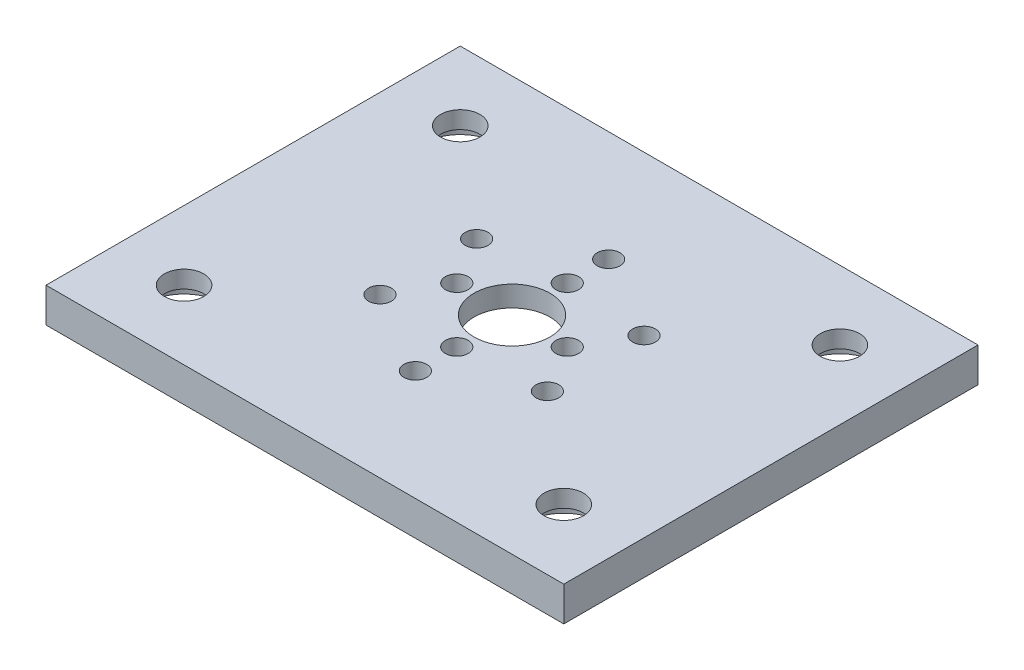
from build123d import *

# Parameters (mm, degrees)
SKETCH_1_W               = 75
SKETCH_1_H               = 60
EXTRUDE_1_DEPTH          = 5
HOLE_WIZARD_1_D          = 5.7
CUT_EXTRUDE_1_DEPTH      = 10
HOLE_WIZARD_2_D          = 3.3
PATTERN_CIRCULAR_1_COUNT = 6
HOLE_WIZARD_3_D          = 11
HOLE_WIZARD_3_DEPTH      = 2.5
HOLE_WIZARD_4_D          = 3.3
HOLE_WIZARD_5_D          = 23
HOLE_WIZARD_5_DEPTH      = 2


with BuildPart() as part:
    # 草图1 → 凸台-拉伸1 (new body)
    with BuildSketch(Plane(origin=(0, 0, 0), x_dir=(1, 0, 0), z_dir=(0, 1, 0))):
        with Locations((37.5, 30)):
            Rectangle(SKETCH_1_W, SKETCH_1_H)
    extrude(amount=EXTRUDE_1_DEPTH)

    # 孔1 (through all)
    with Locations(Plane(origin=(0, 5, 0), x_dir=(1, 0, 0), z_dir=(0, 1, 0))):
        with Locations((10, 50), (10, 10), (65, 10), (65, 50)):
            Hole(HOLE_WIZARD_1_D / 2)

    # 草图6 → 切除-拉伸1 (cut)
    with BuildSketch(Plane(origin=(0, 5, 0), x_dir=(1, 0, 0), z_dir=(0, 1, 0))):
        with BuildLine():
            ThreePointArc((43, 30), (37.5, 35.5), (32, 30))
            Line((32, 30), (43, 30))
        make_face()
        with BuildLine():
            Line((43, 30), (32, 30))
            ThreePointArc((32, 30), (37.5, 24.5), (43, 30))
        make_face()
    extrude(amount=-CUT_EXTRUDE_1_DEPTH, mode=Mode.SUBTRACT)

    # 孔2 (through all)
    with Locations(Plane(origin=(0, 5, 0), x_dir=(1, 0, 0), z_dir=(0, 1, 0))):
        with Locations((37.5, 44)):
            hole_wizard_2 = Hole(HOLE_WIZARD_2_D / 2)

    # 阵列(圆周)1: 孔2 ×6 about axis
    pattern_circular_1_axis = Axis((37.5, 0, -30), (0, 1, 0))
    for i in range(1, PATTERN_CIRCULAR_1_COUNT):
        add(hole_wizard_2.rotate(pattern_circular_1_axis, i * 360 / PATTERN_CIRCULAR_1_COUNT), mode=Mode.SUBTRACT)

    # 孔3
    with Locations(Plane(origin=(0, 0, 0), x_dir=(-1, 0, 0), z_dir=(0, -1, 0))):
        with Locations((-10, 10), (-10, 50), (-65, 50), (-65, 10)):
            Hole(HOLE_WIZARD_3_D / 2, depth=HOLE_WIZARD_3_DEPTH)

    # 孔4 (through all)
    with Locations(Plane(origin=(0, 5, 0), x_dir=(1, 0, 0), z_dir=(0, 1, 0))):
        with Locations((29.5, 30), (37.5, 38), (45.5, 30), (37.5, 22)):
            Hole(HOLE_WIZARD_4_D / 2)

    # 孔5
    with Locations(Plane(origin=(0, 0, 0), x_dir=(-1, 0, 0), z_dir=(0, -1, 0))):
        with Locations((-37.5, 30)):
            Hole(HOLE_WIZARD_5_D / 2, depth=HOLE_WIZARD_5_DEPTH)


solid = part.part
